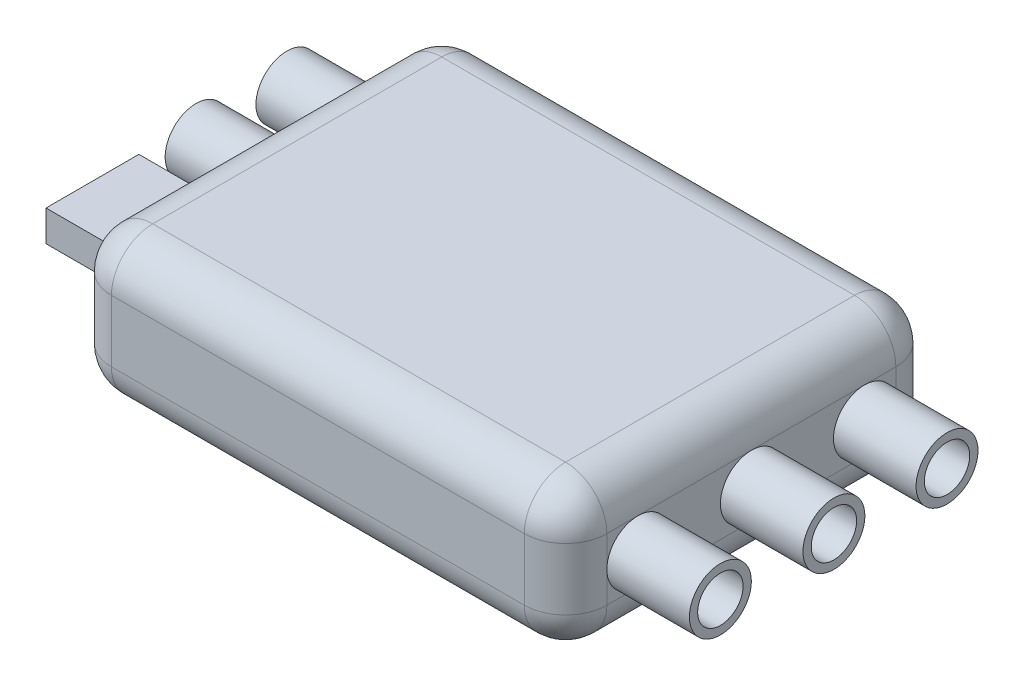
from build123d import *

# Parameters (mm, degrees)
BOSS_EXTRUDE1_DEPTH = 7
FILLET1_R           = 2
SKETCH2_R           = 1.5
SKETCH2_R_2         = 1.1
BOSS_EXTRUDE2_DEPTH = 4
SKETCH3_R           = 1.5
SKETCH3_R_2         = 1.1
SKETCH3_W           = 4.5
SKETCH3_H           = 1.5
BOSS_EXTRUDE3_DEPTH = 4


with BuildPart() as part:
    # Sketch1 → Boss-Extrude1 (new body)
    with BuildSketch(Plane(origin=(0, 0, 0), x_dir=(1, 0, 0), z_dir=(0, 1, 0))):
        with BuildLine():
            Line((-10, 9), (10, 9))
            ThreePointArc((10, 9), (11.414213562, 8.414213562), (12, 7))
            Line((12, 7), (12, -7))
            ThreePointArc((12, -7), (11.414213562, -8.414213562), (10, -9))
            Line((10, -9), (-10, -9))
            ThreePointArc((-10, -9), (-11.414213562, -8.414213562), (-12, -7))
            Line((-12, -7), (-12, 7))
            ThreePointArc((-12, 7), (-11.414213562, 8.414213562), (-10, 9))
        make_face()
    extrude(amount=BOSS_EXTRUDE1_DEPTH)

    # Fillet1
    fillet1_edges = [part.edges().sort_by_distance(p)[0] for p in [
        (12, 0, 0),
        (11.414213562, 0, 8.414213562),
        (0, 0, 9),
        (-11.414213562, 0, 8.414213562),
        (11.414213562, 7, 8.414213562),
        (12, 7, 0),
        (11.414213562, 7, -8.414213562),
        (0, 7, -9),
        (-11.414213562, 7, -8.414213562),
        (-12, 7, 0),
        (-11.414213562, 7, 8.414213562),
        (-12, 0, 0),
        (0, 7, 9),
        (-11.414213562, 0, -8.414213562),
        (0, 0, -9),
        (11.414213562, 0, -8.414213562),
    ]]
    fillet(fillet1_edges, radius=FILLET1_R)

    # Sketch2 → Boss-Extrude2 (add)
    # profile 1 of 3: a face of its own
    with BuildSketch(Plane(origin=(12, 0, 0), x_dir=(0, 0, -1), z_dir=(1, 0, 0))):
        with Locations(Location((0, 3.5, 0), (0, 0, 270))):
            Circle(SKETCH2_R)
        with Locations((0, 3.5)):
            Circle(SKETCH2_R_2, mode=Mode.SUBTRACT)
    # profile 2 of 3: a face of its own
    with BuildSketch(Plane(origin=(12, 0, 0), x_dir=(0, 0, -1), z_dir=(1, 0, 0))):
        with Locations(Location((-5.5, 3.5, 0), (0, 0, 180))):
            Circle(SKETCH2_R)
        with Locations((-5.5, 3.5)):
            Circle(SKETCH2_R_2, mode=Mode.SUBTRACT)
    # profile 3 of 3: a face of its own
    with BuildSketch(Plane(origin=(12, 0, 0), x_dir=(0, 0, -1), z_dir=(1, 0, 0))):
        with Locations(Location((5.479960671, 3.5, 0), (0, 0, 270))):
            Circle(SKETCH2_R)
        with Locations((5.479960671, 3.5)):
            Circle(SKETCH2_R_2, mode=Mode.SUBTRACT)
    extrude(amount=BOSS_EXTRUDE2_DEPTH)

    # Sketch3 → Boss-Extrude3 (add)
    # profile 1 of 3: a face of its own
    with BuildSketch(Plane.ZY.offset(12)):
        with Locations(Location((-5.5, 3.5, 0), (0, 0, 180))):
            Circle(SKETCH3_R)
        with Locations((-5.5, 3.5)):
            Circle(SKETCH3_R_2, mode=Mode.SUBTRACT)
    # profile 2 of 3: a face of its own
    with BuildSketch(Plane.ZY.offset(12)):
        with Locations(Location((-1.1, 3.5, 0), (0, 0, 270))):
            Circle(SKETCH3_R)
        with Locations((-1.1, 3.5)):
            Circle(SKETCH3_R_2, mode=Mode.SUBTRACT)
    # profile 3 of 3: a face of its own
    with BuildSketch(Plane.ZY.offset(12)):
        with Locations((3.921006342, 3.5)):
            Rectangle(SKETCH3_W, SKETCH3_H)
    extrude(amount=BOSS_EXTRUDE3_DEPTH)


solid = part.part
